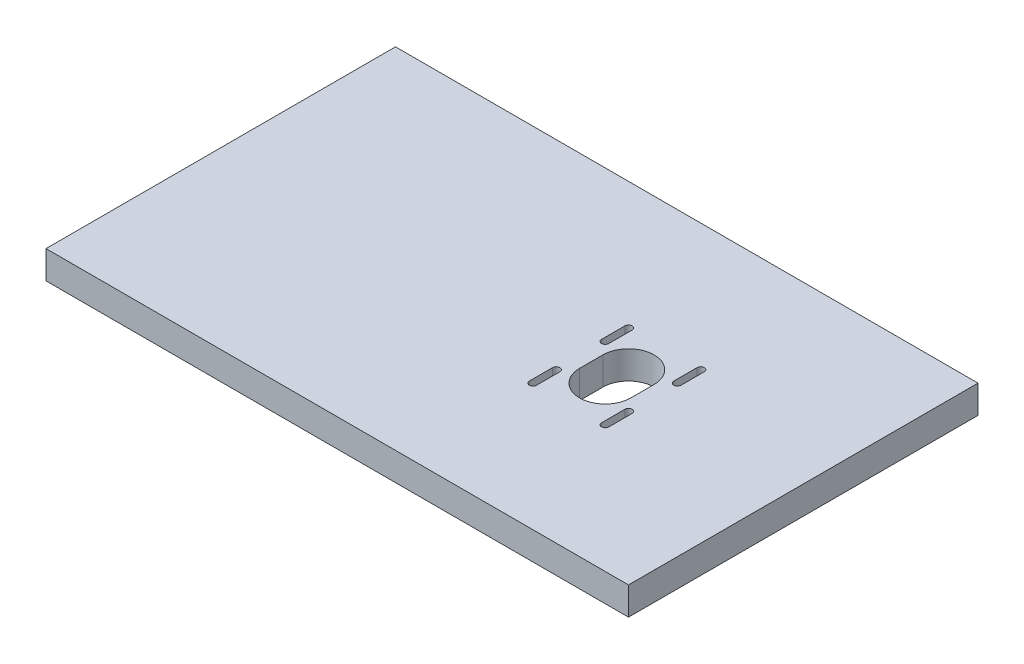
from build123d import *

# Parameters (mm, degrees)
SKIZZE1_W                       = 250
SKIZZE1_H                       = 150
AUFSATZ_LINEAR_AUSTRAGEN1_DEPTH = 12


with BuildPart() as part:
    # Skizze1 → Aufsatz-Linear austragen1 (new body)
    with BuildSketch(Plane(origin=(0, 0, 0), x_dir=(1, 0, 0), z_dir=(0, 1, 0))):
        Rectangle(SKIZZE1_W, SKIZZE1_H)
        with BuildLine():
            Line((27.95, 10.5), (27.95, 20.5))
            ThreePointArc((27.95, 20.5), (29.5, 22.05), (31.05, 20.5))
            Line((31.05, 20.5), (31.05, 10.5))
            ThreePointArc((31.05, 10.5), (29.5, 8.95), (27.95, 10.5))
        make_face(mode=Mode.SUBTRACT)
        with BuildLine():
            Line((62.05, 20.5), (62.05, 10.5))
            ThreePointArc((62.05, 10.5), (60.5, 8.95), (58.95, 10.5))
            Line((58.95, 10.5), (58.95, 20.5))
            ThreePointArc((58.95, 20.5), (60.5, 22.05), (62.05, 20.5))
        make_face(mode=Mode.SUBTRACT)
        with BuildLine():
            Line((58.95, -20.5), (58.95, -10.5))
            ThreePointArc((58.95, -10.5), (60.5, -8.95), (62.05, -10.5))
            Line((62.05, -10.5), (62.05, -20.5))
            ThreePointArc((62.05, -20.5), (60.5, -22.05), (58.95, -20.5))
        make_face(mode=Mode.SUBTRACT)
        with BuildLine():
            Line((27.95, -20.5), (27.95, -10.5))
            ThreePointArc((27.95, -10.5), (29.5, -8.95), (31.05, -10.5))
            Line((31.05, -10.5), (31.05, -20.5))
            ThreePointArc((31.05, -20.5), (29.5, -22.05), (27.95, -20.5))
        make_face(mode=Mode.SUBTRACT)
        with BuildLine():
            Line((56, 5), (56, -5))
            ThreePointArc((56, -5), (45, -16), (34, -5))
            Line((34, -5), (34, 5))
            ThreePointArc((34, 5), (45, 16), (56, 5))
        make_face(mode=Mode.SUBTRACT)
    extrude(amount=AUFSATZ_LINEAR_AUSTRAGEN1_DEPTH)


solid = part.part
